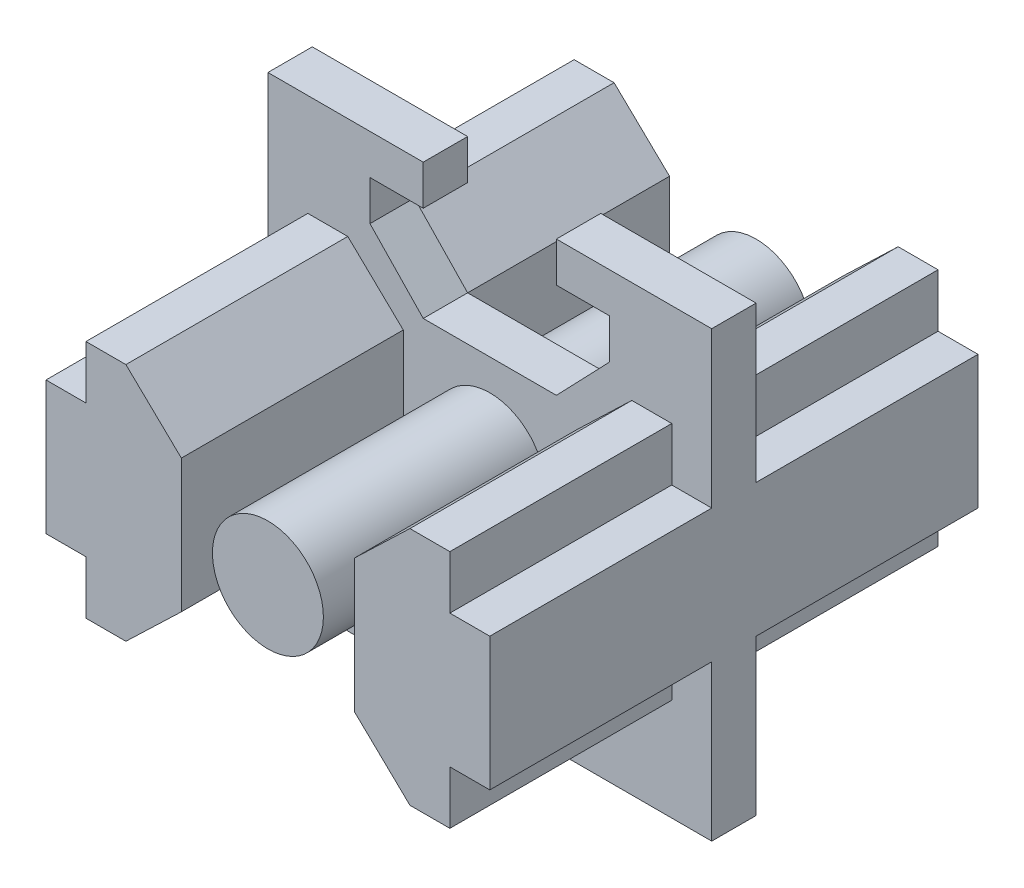
from build123d import *

# Parameters (mm, degrees)
BOSS_EXTRUDE1_DEPTH   = 11
BOSS_EXTRUDE1_2_DEPTH = 11
SKETCH1_R             = 2.5
BOSS_EXTRUDE1_3_DEPTH = 11
SKETCH1_11_R          = 2.5
BOSS_EXTRUDE2_DEPTH   = 1


with BuildPart() as part:
    # Sketch1 → Boss-Extrude1 (new, symmetric)
    with BuildSketch(Plane.XY):
        Polygon((0, -7), (0, -13), (1.8, -13), (1.8, -15.4), (3.6, -15.4), (6.1, -13), (6.1, -7), (3.6, -4.6), (1.8, -4.6), (1.8, -7), align=None)
    extrude(amount=BOSS_EXTRUDE1_DEPTH, both=True)



with BuildPart() as body_2:
    # Sketch1 → Boss-Extrude1 2 (new, symmetric)
    with BuildSketch(Plane.XY):
        Polygon((20, -7), (18.2, -7), (18.2, -4.6), (16.4, -4.6), (13.9, -7), (13.9, -13), (16.4, -15.4), (18.2, -15.4), (18.2, -13), (20, -13), align=None)
    extrude(amount=BOSS_EXTRUDE1_2_DEPTH, both=True)


with BuildPart() as body_3:
    # Sketch1 → Boss-Extrude1 3 (new, symmetric)
    with BuildSketch(Plane.XY):
        with Locations((10, -10)):
            Circle(SKETCH1_R)
    extrude(amount=BOSS_EXTRUDE1_3_DEPTH, both=True)


with BuildPart() as part_1:
    add(part.part)

    add(body_2.part)  # Boss-Extrude2 merges body 2

    add(body_3.part)  # Boss-Extrude2 merges body 3
    # Sketch1<11> → Boss-Extrude2 (add, symmetric)
    with BuildSketch(Plane.XY):
        Polygon((7, -1.8), (7, 0), (0, 0), (0, -7), (0.4, -7), (1.8, -7), (1.8, -4.6), (2.2, -4.6), (3.6, -4.6), (6.1, -7), (6.1, -13), (3.6, -15.4), (1.8, -15.4), (1.8, -13), (0.4, -13), (0, -13), (0, -20), (7, -20), (7, -18.2), (4.6, -18.2), (4.6, -16.4), (7, -13.9), (7.016, -13.9), (13, -13.9), (15.4, -16.4), (15.4, -18.2), (13, -18.2), (13, -19.6), (13, -20), (20, -20), (20, -13), (18.2, -13), (18.2, -15), (18.2, -15.4), (16.4, -15.4), (13.9, -13), (13.9, -12.6), (13.9, -7), (16.4, -4.6), (18.2, -4.6), (18.2, -7), (20, -7), (20, -6.6), (20, 0), (13, 0), (13, -1.8), (15.4, -1.8), (15.4, -3.6), (13, -6.1), (7, -6.1), (4.6, -3.6), (4.6, -1.8), align=None)
        with Locations((10, -10)):
            Circle(SKETCH1_11_R, mode=Mode.SUBTRACT)
    extrude(amount=BOSS_EXTRUDE2_DEPTH, both=True)


solid = part_1.part
